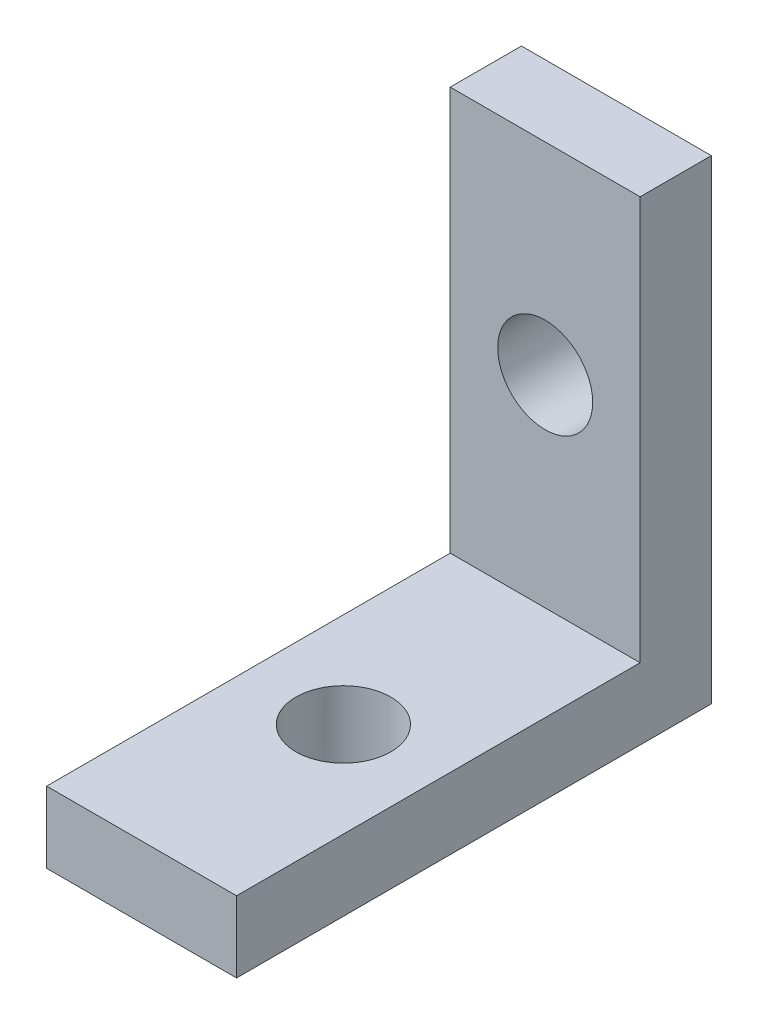
from build123d import *

# Parameters (mm, degrees)
SKETCH1_W           = 8
SKETCH1_H           = 20
BOSS_EXTRUDE1_DEPTH = 3
SKETCH2_W           = 8
SKETCH2_H           = 3
BOSS_EXTRUDE2_DEPTH = 17
SKETCH3_R           = 2
CUT_EXTRUDE1_DEPTH  = 17
SKETCH4_R           = 2
CUT_EXTRUDE2_DEPTH  = 17


with BuildPart() as part:
    # Sketch1 → Boss-Extrude1 (new body)
    with BuildSketch(Plane(origin=(0, 0, 0), x_dir=(1, 0, 0), z_dir=(0, 1, 0))):
        Rectangle(SKETCH1_W, SKETCH1_H)
    extrude(amount=BOSS_EXTRUDE1_DEPTH)

    # Sketch2 → Boss-Extrude2 (add)
    with BuildSketch(Plane(origin=(0, 3, 0), x_dir=(1, 0, 0), z_dir=(0, 1, 0))):
        with Locations((0, 8.5)):
            Rectangle(SKETCH2_W, SKETCH2_H)
    extrude(amount=BOSS_EXTRUDE2_DEPTH)

    # Sketch3 → Cut-Extrude1 (cut)
    with BuildSketch(Plane(origin=(0, 3, 0), x_dir=(1, 0, 0), z_dir=(0, 1, 0))):
        with Locations((0, -1.5)):
            Circle(SKETCH3_R)
    extrude(amount=-CUT_EXTRUDE1_DEPTH, mode=Mode.SUBTRACT)

    # Sketch4 → Cut-Extrude2 (cut)
    with BuildSketch(Plane.XY.offset(-7)):
        with Locations((0, 11.5)):
            Circle(SKETCH4_R)
    extrude(amount=-CUT_EXTRUDE2_DEPTH, mode=Mode.SUBTRACT)


solid = part.part
